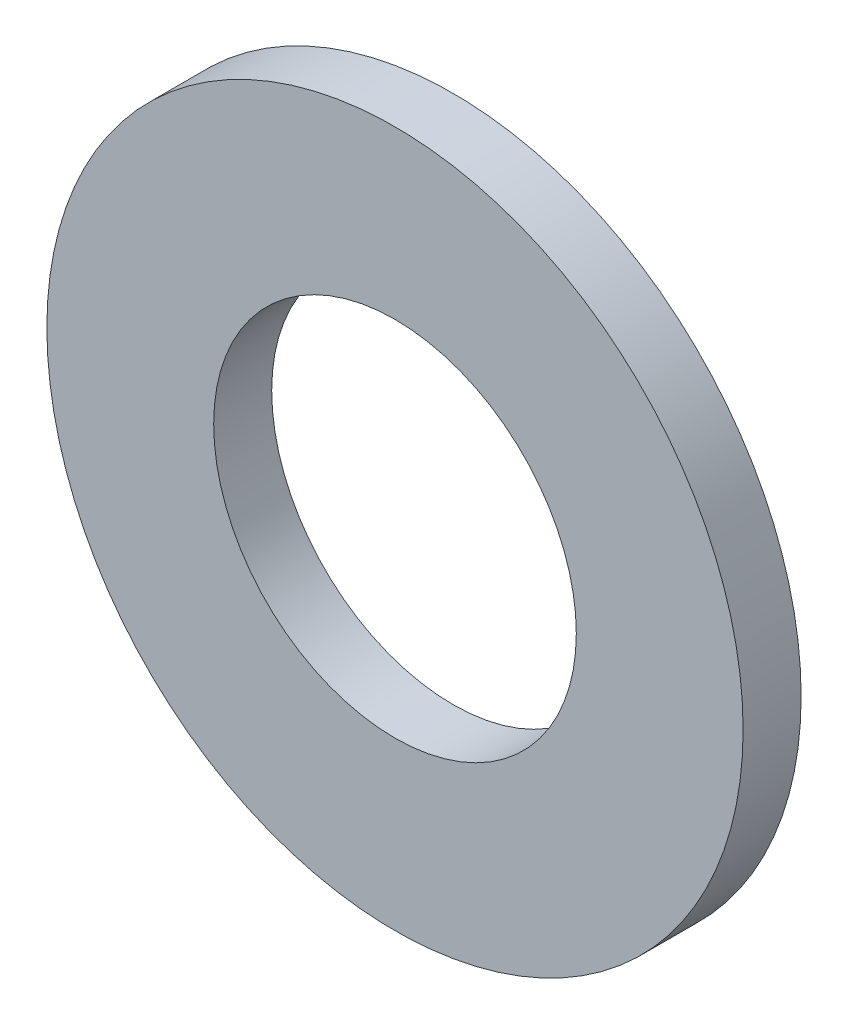
from build123d import *

# Parameters (mm, degrees)
SKETCH2_R           = 6
SKETCH2_R_2         = 3.125
BOSS_EXTRUDE1_DEPTH = 0.5


with BuildPart() as part:
    # Sketch2 → Boss-Extrude1 (new, symmetric)
    with BuildSketch(Plane.XY):
        Circle(SKETCH2_R)
        Circle(SKETCH2_R_2, mode=Mode.SUBTRACT)
    extrude(amount=BOSS_EXTRUDE1_DEPTH, both=True)


solid = part.part
